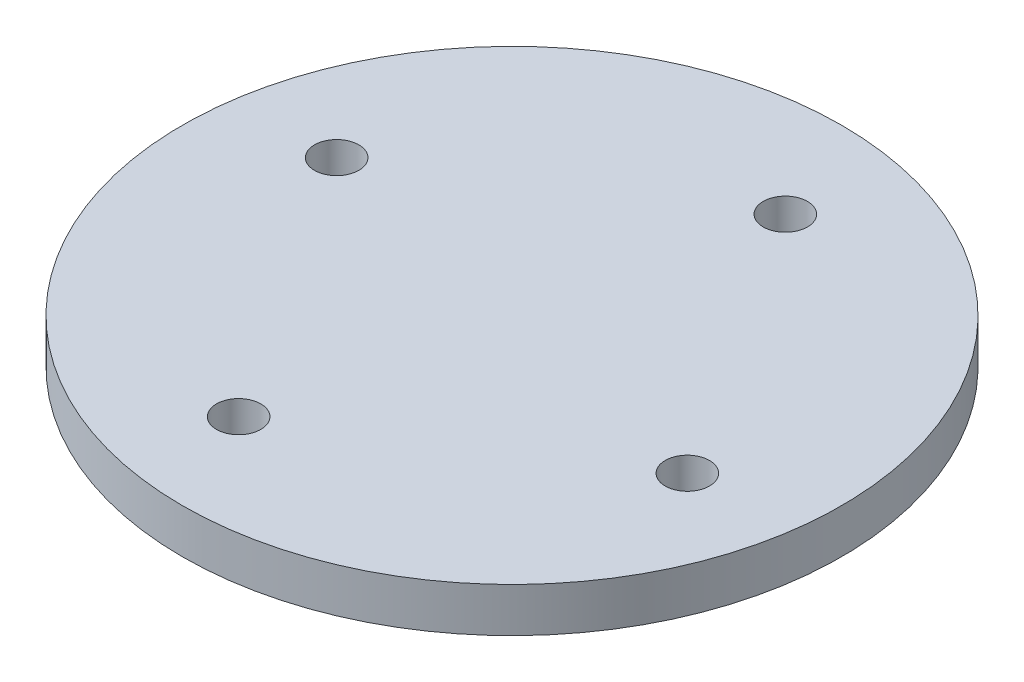
from build123d import *

# Parameters (mm, degrees)
SKETCH1_R           = 14.875
SKETCH1_R_2         = 1
BOSS_EXTRUDE1_DEPTH = 2


with BuildPart() as part:
    # Sketch1 → Boss-Extrude1 (new body)
    with BuildSketch(Plane(origin=(0, 0, 0), x_dir=(1, 0, 0), z_dir=(0, 1, 0))):
        with Locations(Location((0, 0, 0), (0, 0, 270))):
            Circle(SKETCH1_R)
        with Locations(Location((2.211637479, 10.12629669, 0), (0, 0, 270))):
            Circle(SKETCH1_R_2, mode=Mode.SUBTRACT)
        with Locations(Location((10.12629669, -2.211637479, 0), (0, 0, 270))):
            Circle(SKETCH1_R_2, mode=Mode.SUBTRACT)
        with Locations(Location((-2.211637479, -10.12629669, 0), (0, 0, 270))):
            Circle(SKETCH1_R_2, mode=Mode.SUBTRACT)
        with Locations(Location((-10.12629669, 2.211637479, 0), (0, 0, 270))):
            Circle(SKETCH1_R_2, mode=Mode.SUBTRACT)
    extrude(amount=BOSS_EXTRUDE1_DEPTH)


solid = part.part
